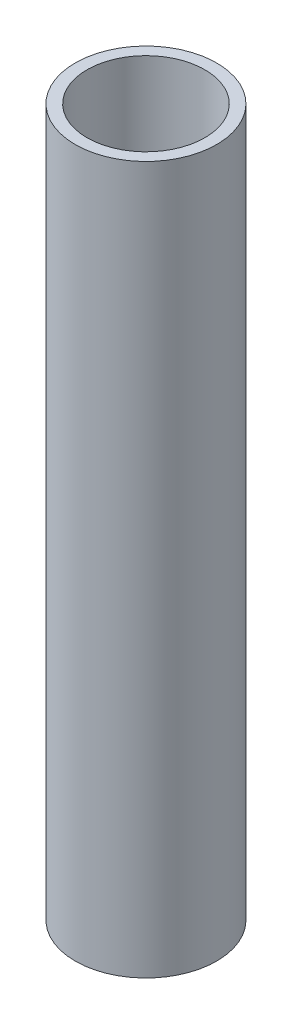
from build123d import *

# Parameters (mm, degrees)
SKETCH1_R           = 19.05
SKETCH1_R_2         = 15.875
BOSS_EXTRUDE1_DEPTH = 190.5


with BuildPart() as part:
    # Sketch1 → Boss-Extrude1 (new body)
    with BuildSketch(Plane(origin=(0, 0, 0), x_dir=(1, 0, 0), z_dir=(0, 1, 0))):
        with Locations(Location((0, 0, 0), (0, 0, 270))):
            Circle(SKETCH1_R)
        with Locations(Location((0, 0, 0), (0, 0, 270))):
            Circle(SKETCH1_R_2, mode=Mode.SUBTRACT)
    extrude(amount=BOSS_EXTRUDE1_DEPTH)


solid = part.part
